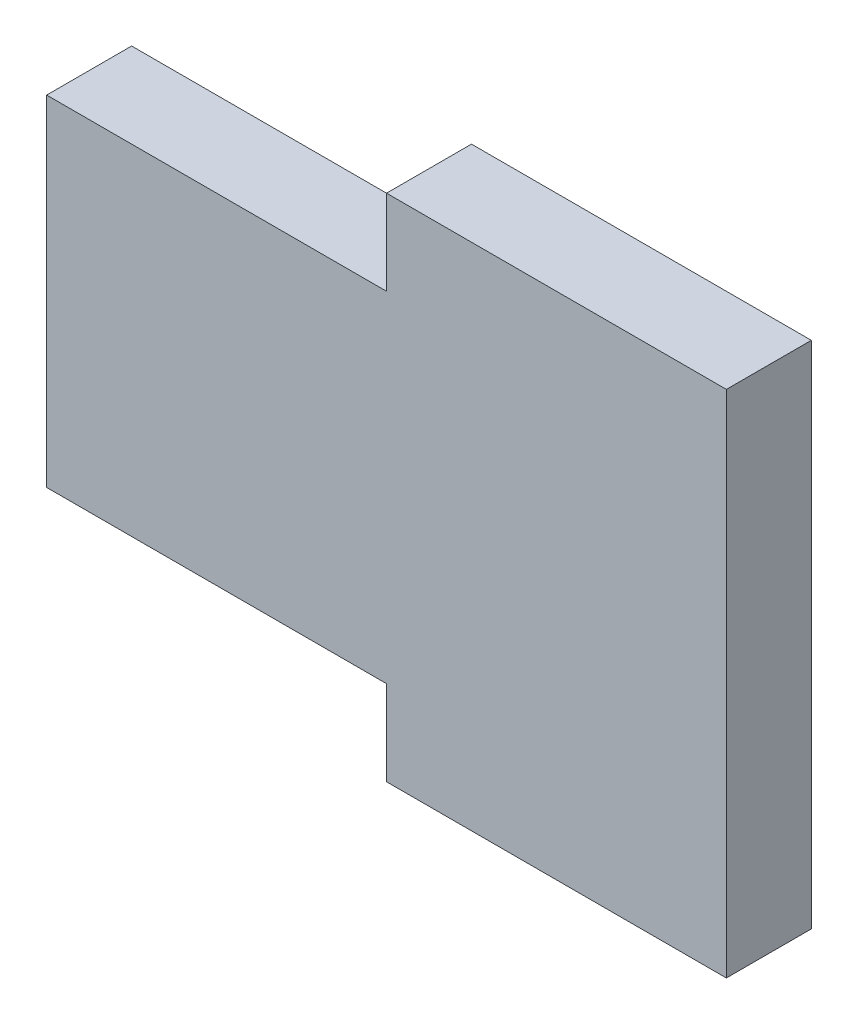
from build123d import *

# Parameters (mm, degrees)
BOSS_EXTRUDE1_DEPTH = 3.175


with BuildPart() as part:
    # Sketch1 → Boss-Extrude1 (new body)
    with BuildSketch(Plane.XY):
        Polygon((288.925, 0), (276.225, 0), (276.225, -3.175), (263.525, -3.175), (263.525, -15.875), (276.225, -15.875), (276.225, -19.05), (288.925, -19.05), align=None)
    extrude(amount=BOSS_EXTRUDE1_DEPTH)


solid = part.part
